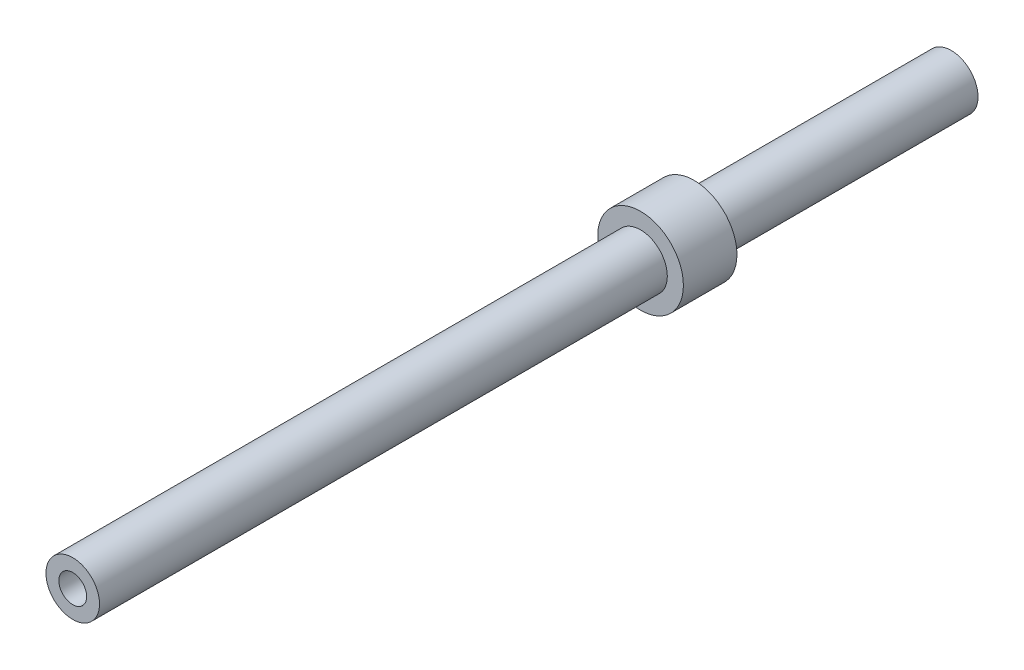
from build123d import *

# Parameters (mm, degrees)
SKETCH1_R                 = 2.5
BOSS_EXTRUDE1_DEPTH       = 24
SKETCH2_R                 = 4
BOSS_EXTRUDE2_DEPTH       = 5
SKETCH3_R                 = 2.5
BOSS_EXTRUDE3_DEPTH       = 53
M3X0_5_TAPPED_HOLE1_D     = 2.6
M3X0_5_TAPPED_HOLE1_DEPTH = 8
M3X0_5_TAPPED_HOLE1_TIP   = 0.781118805
M3X0_5_TAPPED_HOLE2_D     = 2.6
M3X0_5_TAPPED_HOLE2_DEPTH = 8
M3X0_5_TAPPED_HOLE2_TIP   = 0.781118805


with BuildPart() as part:
    # Sketch1 → Boss-Extrude1 (new body)
    with BuildSketch(Plane.XY):
        Circle(SKETCH1_R)
    extrude(amount=BOSS_EXTRUDE1_DEPTH)

    # Sketch2 → Boss-Extrude2 (add)
    with BuildSketch(Plane.XY.offset(24)):
        Circle(SKETCH2_R)
    extrude(amount=BOSS_EXTRUDE2_DEPTH)

    # Sketch3 → Boss-Extrude3 (add)
    with BuildSketch(Plane.XY.offset(29)):
        Circle(SKETCH3_R)
    extrude(amount=BOSS_EXTRUDE3_DEPTH)

    # M3x0.5 Tapped Hole1
    with Locations(Plane.XY.offset(82)):
        with Locations((0, 0)):
            Hole(M3X0_5_TAPPED_HOLE1_D / 2, depth=M3X0_5_TAPPED_HOLE1_DEPTH)
            with Locations((0, 0, -(M3X0_5_TAPPED_HOLE1_DEPTH + M3X0_5_TAPPED_HOLE1_TIP / 2))):  # 118° drill point
                Cone(0, M3X0_5_TAPPED_HOLE1_D / 2, M3X0_5_TAPPED_HOLE1_TIP, mode=Mode.SUBTRACT)

    # M3x0.5 Tapped Hole2
    with Locations(Plane(origin=(0, 0, 0), x_dir=(-1, 0, 0), z_dir=(0, 0, -1))):
        with Locations((0, 0)):
            Hole(M3X0_5_TAPPED_HOLE2_D / 2, depth=M3X0_5_TAPPED_HOLE2_DEPTH)
            with Locations((0, 0, -(M3X0_5_TAPPED_HOLE2_DEPTH + M3X0_5_TAPPED_HOLE2_TIP / 2))):  # 118° drill point
                Cone(0, M3X0_5_TAPPED_HOLE2_D / 2, M3X0_5_TAPPED_HOLE2_TIP, mode=Mode.SUBTRACT)


solid = part.part
